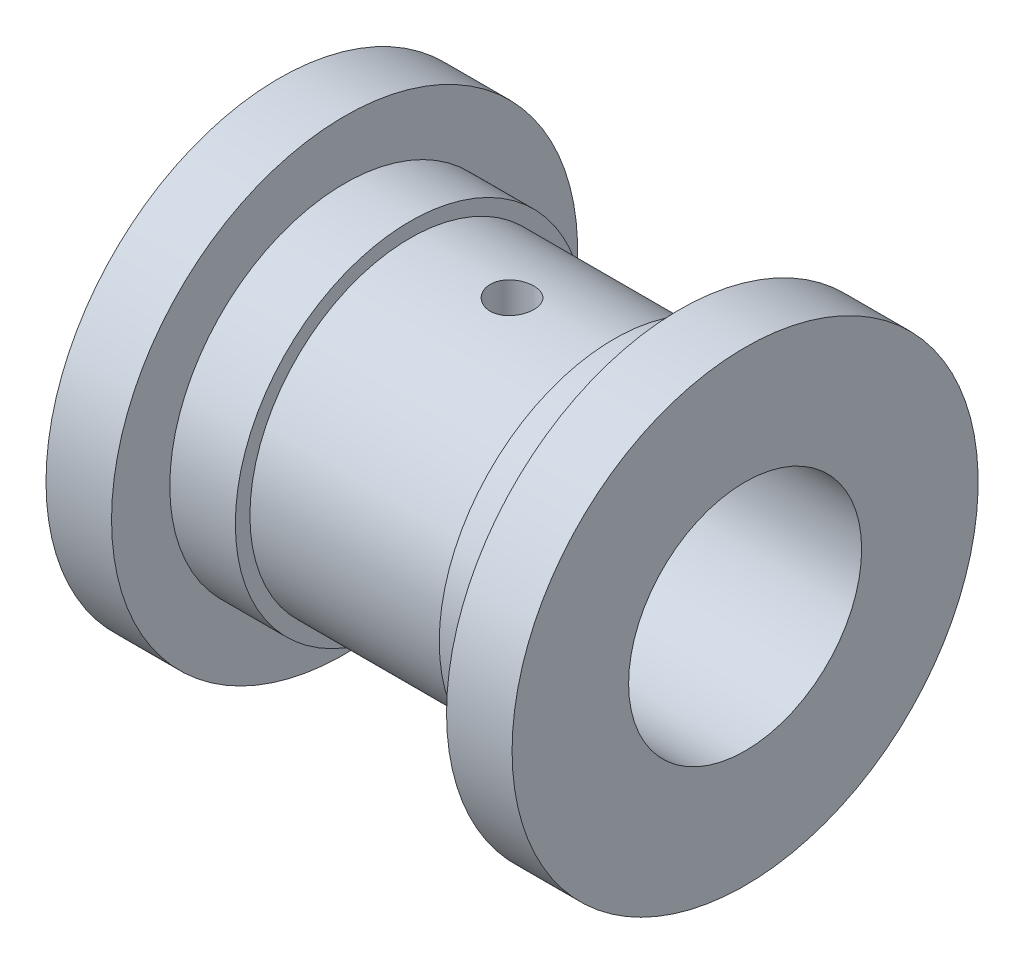
from build123d import *

# Parameters (mm, degrees)
BOSS_EXTRUDE1_REACH      = 78.759
BOSS_EXTRUDE1_END_RADIUS = 22
SKETCH2_R                = 4
F_1_0MM_DOWEL_HOLE1_D    = 6


with BuildPart() as part:
    # Sketch1 → Revolve1 (revolve)
    with BuildSketch(Plane.XY, mode=Mode.PRIVATE) as revolve1_sk:
        Polygon((-32, 16), (32, 16), (32, 32), (23, 32), (23, 24), (14, 24), (14, 22), (-14, 22), (-14, 24), (-23, 24), (-23, 32), (-32, 32), align=None)
    revolve(revolve1_sk.sketch.rotate(Axis((0, 0, 0), (1, 0, 0)), 90), axis=Axis((0, 0, 0), (1, 0, 0)))

    # Boss-Extrude1: up to this cylinder (the profile starts outside it)
    boss_extrude1_end = Plane(origin=(0, 0, 0), z_dir=(-1, 0, 0)) * Cylinder(BOSS_EXTRUDE1_END_RADIUS, 202.518, mode=Mode.PRIVATE)
    # Sketch2 → Boss-Extrude1 (add, up to the surface)
    with BuildSketch(Plane(origin=(0, -30, 0), x_dir=(1, 0, 0), z_dir=(0, 1, 0)), mode=Mode.PRIVATE) as boss_extrude1_sk1:
        with Locations(Location((0, 0, 0), (0, 0, 90))):
            Circle(SKETCH2_R)
    boss_extrude1_tool1 = extrude(boss_extrude1_sk1.sketch, amount=BOSS_EXTRUDE1_REACH, mode=Mode.PRIVATE) - boss_extrude1_end
    add(boss_extrude1_tool1.solids().sort_by_distance((0, -30, 0))[0])

    # Ø1.0mm Dowel Hole1 (through all)
    with Locations(Plane(origin=(0, -30, 0), x_dir=(-1, 0, 0), z_dir=(0, -1, 0))):
        with Locations((0, 0)):
            Hole(F_1_0MM_DOWEL_HOLE1_D / 2)


solid = part.part
